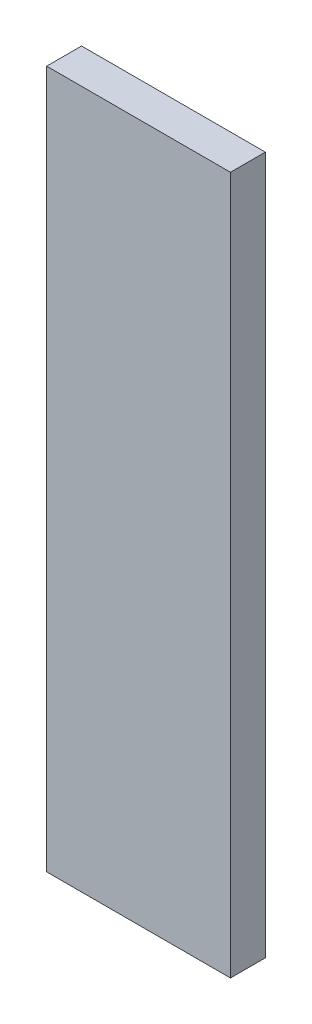
from build123d import *

# Parameters (mm, degrees)
ESQUISSE1_W        = 33.4518
ESQUISSE1_H        = 127
BOSS_EXTRU_1_DEPTH = 6.35


with BuildPart() as part:
    # Esquisse1 → Boss.-Extru.1 (new body)
    with BuildSketch(Plane.XY):
        Rectangle(ESQUISSE1_W, ESQUISSE1_H)
    extrude(amount=BOSS_EXTRU_1_DEPTH)


solid = part.part
